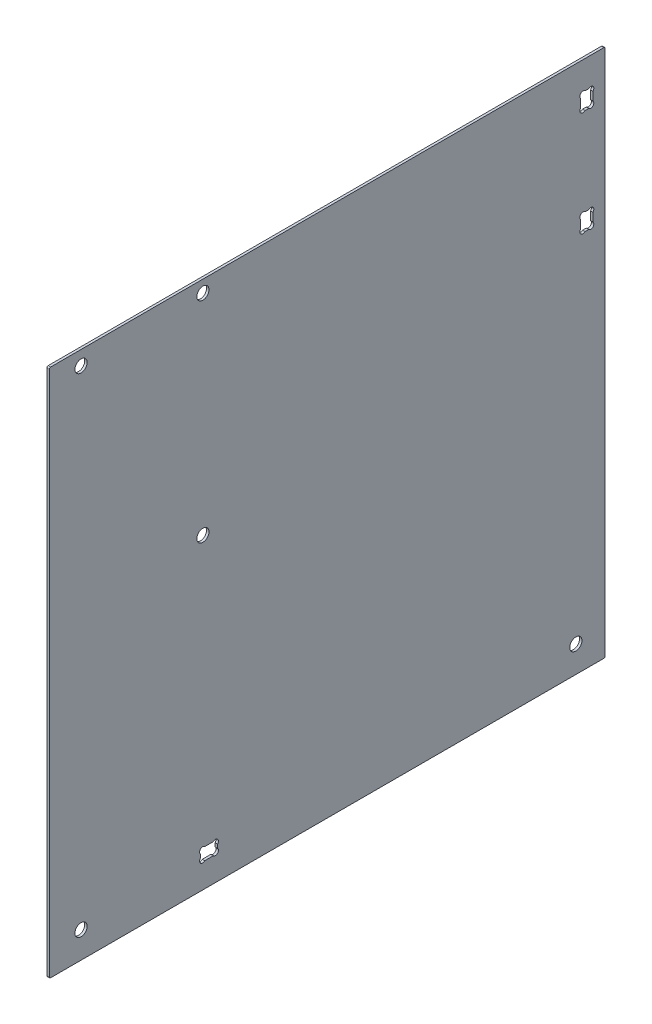
from build123d import *

# Parameters (mm, degrees)
SKETCH1_W           = 228
SKETCH1_H           = 217
SKETCH1_R           = 2.5
SKETCH1_W_2         = 5
SKETCH1_H_2         = 7
SKETCH1_W_3         = 7
SKETCH1_H_3         = 5
BOSS_EXTRUDE1_DEPTH = 1
SKETCH3_R           = 1.25
CUT_EXTRUDE3_DEPTH  = 315.760226204
FILLET1_R           = 0.5


with BuildPart() as part:
    # Sketch1 → Boss-Extrude1 (new body)
    with BuildSketch(Plane(origin=(0, 0, 0), x_dir=(0, 0, -1), z_dir=(1, 0, 0))):
        with Locations((-114, 108.5)):
            Rectangle(SKETCH1_W, SKETCH1_H)
        with Locations((-215, 10.85)):
            Circle(SKETCH1_R, mode=Mode.SUBTRACT)
        with Locations((-215, 211.15)):
            Circle(SKETCH1_R, mode=Mode.SUBTRACT)
        with Locations((-165, 212)):
            Circle(SKETCH1_R, mode=Mode.SUBTRACT)
        with Locations((-165, 126)):
            Circle(SKETCH1_R, mode=Mode.SUBTRACT)
        with Locations((-12, 10.85)):
            Circle(SKETCH1_R, mode=Mode.SUBTRACT)
        with Locations((-7.5, 202)):
            Rectangle(SKETCH1_W_2, SKETCH1_H_2, mode=Mode.SUBTRACT)
        with Locations((-7.5, 159)):
            Rectangle(SKETCH1_W_2, SKETCH1_H_2, mode=Mode.SUBTRACT)
        with Locations((-162.5, 12.5)):
            Rectangle(SKETCH1_W_3, SKETCH1_H_3, mode=Mode.SUBTRACT)
    extrude(amount=BOSS_EXTRUDE1_DEPTH)

    # Sketch3 → Cut-Extrude3 (cut, through all)
    with BuildSketch(Plane.ZY):
        with Locations((5.883883476, 204.616116524)):
            Circle(SKETCH3_R)
        with Locations((9.116116524, 204.616116524)):
            Circle(SKETCH3_R)
        with Locations((5.883883476, 199.383883476)):
            Circle(SKETCH3_R)
        with Locations((9.116116524, 199.383883476)):
            Circle(SKETCH3_R)
        with Locations((9.116116524, 161.616116524)):
            Circle(SKETCH3_R)
        with Locations((5.883883476, 161.616116524)):
            Circle(SKETCH3_R)
        with Locations((9.116116524, 156.383883476)):
            Circle(SKETCH3_R)
        with Locations((5.883883476, 156.383883476)):
            Circle(SKETCH3_R)
        with Locations((165.116116524, 14.116116524)):
            Circle(SKETCH3_R)
        with Locations((165.116116524, 10.883883476)):
            Circle(SKETCH3_R)
        with Locations((159.883883476, 10.883883476)):
            Circle(SKETCH3_R)
        with Locations((159.883883476, 14.116116524)):
            Circle(SKETCH3_R)
    extrude(amount=-CUT_EXTRUDE3_DEPTH, mode=Mode.SUBTRACT)

    # Fillet1
    fillet1_edges = [part.edges().sort_by_distance(p)[0] for p in [
        (0.5, 0, 0),
        (0.5, 0, 228),
        (0.5, 217, 228),
        (0.5, 217, 0),
    ]]
    fillet(fillet1_edges, radius=FILLET1_R)


solid = part.part
